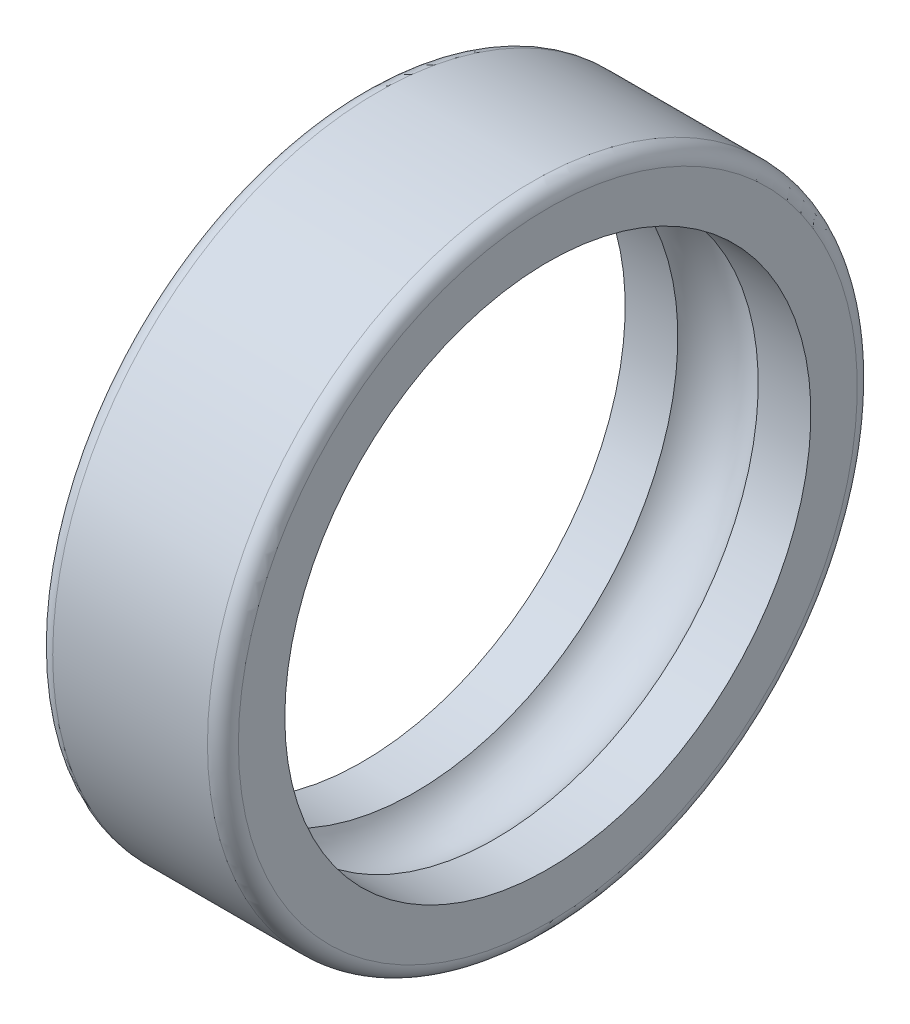
from build123d import *


with BuildPart() as part:
    # Esquisse1 → Base-Révolution (revolve)
    with BuildSketch(Plane.XY, mode=Mode.PRIVATE) as base_r_volution_sk:
        with BuildLine():
            Line((-7, 104.5), (-3.598076211, 104.5))
            ThreePointArc((-3.598076211, 104.5), (-1, 106), (1.598076211, 104.5))
            Line((1.598076211, 104.5), (5, 104.5))
            Line((5, 104.5), (5, 107.5))
            ThreePointArc((5, 107.5), (4.707106781, 108.207106781), (4, 108.5))
            Line((4, 108.5), (-6, 108.5))
            ThreePointArc((-6, 108.5), (-6.707106781, 108.207106781), (-7, 107.5))
            Line((-7, 107.5), (-7, 104.5))
        make_face()
    revolve(base_r_volution_sk.sketch.rotate(Axis((-11.189264063, 87.5, 0), (1, 0, 0)), 90), axis=Axis((-11.189264063, 87.5, 0), (1, 0, 0)))


solid = part.part
